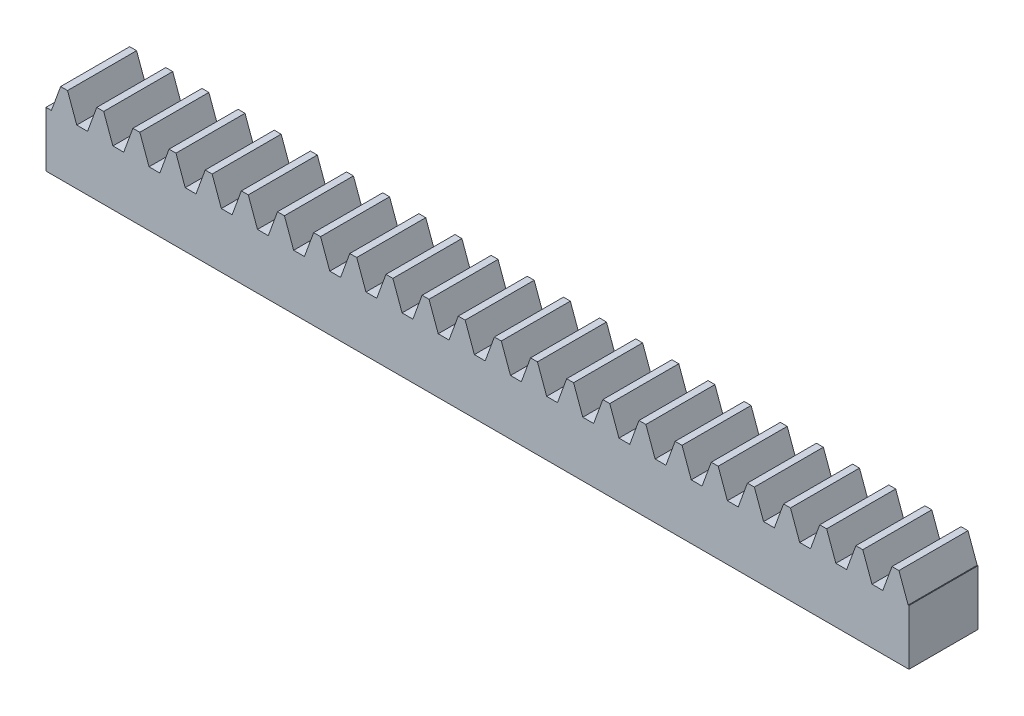
from build123d import *

# Parameters (mm, degrees)
BLANKSKE_W        = 79.375
BLANKSKE_H        = 7.408333333
BLANK_DEPTH       = 6.35
TOOTHCUTSIM_DEPTH = 80.972473563
TEETHCUTS_COUNT   = 25
TEETHCUTS_PITCH   = 3.324852221


with BuildPart() as part:
    # BlankSke → Blank (new body)
    with BuildSketch(Plane.XY):
        with Locations((39.6875, 3.704166667)):
            Rectangle(BLANKSKE_W, BLANKSKE_H)
    extrude(amount=-BLANK_DEPTH)

    # TooCutSkeSim → ToothCutSim (cut, through all)
    with BuildSketch(Plane.XY):
        Polygon((0.496986858, 5.08), (-0.496986858, 5.08), (-1.353675731, 7.433733333), (1.353675731, 7.433733333), align=None)
    toothcutsim = extrude(amount=-TOOTHCUTSIM_DEPTH, mode=Mode.SUBTRACT)

    # TeethCuts: ToothCutSim ×25
    with Locations(*[(i * TEETHCUTS_PITCH, 0, 0) for i in range(1, TEETHCUTS_COUNT)]):
        add(toothcutsim, mode=Mode.SUBTRACT)


solid = part.part
